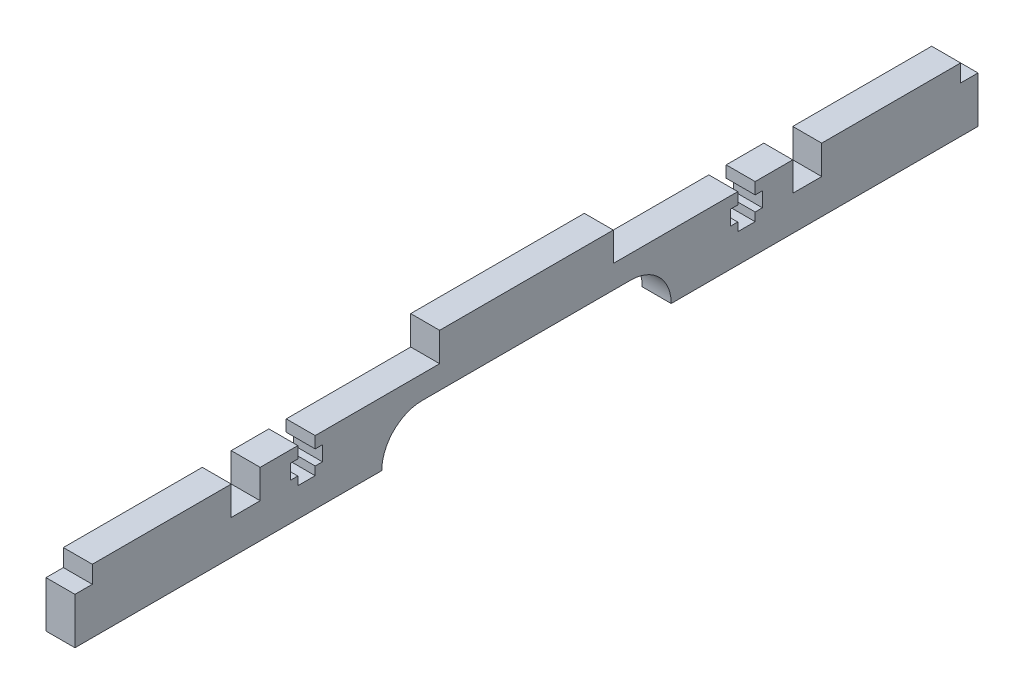
from build123d import *

# Parameters (mm, degrees)
SKETCH1_W           = 5
SKETCH1_H           = 11
BOSS_EXTRUDE1_DEPTH = 150
CUT_EXTRUDE1_DEPTH  = 161.573187019
SKETCH3_W           = 5
SKETCH3_H           = 30
BOSS_EXTRUDE2_DEPTH = 5
CUT_EXTRUDE2_DEPTH  = 163.417988138
SKETCH6_W           = 5
SKETCH6_H           = 8
BOSS_EXTRUDE3_DEPTH = 3
SKETCH7_W           = 5
SKETCH7_H           = 8
BOSS_EXTRUDE4_DEPTH = 3
SKETCH8_W           = 5
SKETCH8_H           = 5
CUT_EXTRUDE3_DEPTH  = 166.192623536


with BuildPart() as part:
    # Sketch1 → Boss-Extrude1 (new body)
    with BuildSketch(Plane.XY):
        with Locations((85.894042166, 51.58544814)):
            Rectangle(SKETCH1_W, SKETCH1_H)
    extrude(amount=BOSS_EXTRUDE1_DEPTH)

    # Sketch2 → Cut-Extrude1 (cut, through all)
    with BuildSketch(Plane(origin=(88.394042166, 0, 0), x_dir=(0, 0, -1), z_dir=(1, 0, 0))):
        with BuildLine():
            Line((-93, 53.08544814), (-57, 53.08544814))
            ThreePointArc((-57, 53.08544814), (-52.050252532, 51.035195608), (-50, 46.08544814))
            Line((-50, 46.08544814), (-100, 46.08544814))
            ThreePointArc((-100, 46.08544814), (-97.949747468, 51.035195608), (-93, 53.08544814))
        make_face()
    extrude(amount=-CUT_EXTRUDE1_DEPTH, mode=Mode.SUBTRACT)

    # Sketch3 → Boss-Extrude2 (add)
    with BuildSketch(Plane(origin=(0, 57.08544814, 0), x_dir=(1, 0, 0), z_dir=(0, 1, 0))):
        with Locations((85.894042166, -75)):
            Rectangle(SKETCH3_W, SKETCH3_H)
    extrude(amount=BOSS_EXTRUDE2_DEPTH)

    # Sketch5 → Cut-Extrude2 (cut, through all)
    with BuildSketch(Plane(origin=(88.394042166, 0, 0), x_dir=(0, 0, -1), z_dir=(1, 0, 0))):
        Polygon((-35.5, 55.08544814), (-34.25, 55.08544814), (-34.25, 52.53544814), (-35.5, 52.53544814), (-35.5, 51.08544814), (-38.5, 51.08544814), (-38.5, 52.53544814), (-39.75, 52.53544814), (-39.75, 55.08544814), (-38.5, 55.08544814), (-38.5, 57.08544814), (-35.5, 57.08544814), align=None)
        Polygon((-114.5, 52.53544814), (-115.75, 52.53544814), (-115.75, 55.08544814), (-114.5, 55.08544814), (-114.5, 57.08544814), (-111.5, 57.08544814), (-111.5, 55.08544814), (-110.25, 55.08544814), (-110.25, 52.53544814), (-111.5, 52.53544814), (-111.5, 51.08544814), (-114.5, 51.08544814), align=None)
    extrude(amount=-CUT_EXTRUDE2_DEPTH, mode=Mode.SUBTRACT)

    # Sketch6 → Boss-Extrude3 (add)
    with BuildSketch(Plane(origin=(0, 0, 0), x_dir=(-1, 0, 0), z_dir=(0, 0, -1))):
        with Locations((-85.894042166, 50.08544814)):
            Rectangle(SKETCH6_W, SKETCH6_H)
    extrude(amount=BOSS_EXTRUDE3_DEPTH)

    # Sketch7 → Boss-Extrude4 (add)
    with BuildSketch(Plane.XY.offset(150)):
        with Locations((85.894042166, 50.08544814)):
            Rectangle(SKETCH7_W, SKETCH7_H)
    extrude(amount=BOSS_EXTRUDE4_DEPTH)

    # Sketch8 → Cut-Extrude3 (cut, through all)
    with BuildSketch(Plane(origin=(88.394042166, 0, 0), x_dir=(0, 0, -1), z_dir=(1, 0, 0))):
        with Locations((-123.5, 54.58544814)):
            Rectangle(SKETCH8_W, SKETCH8_H)
        with Locations((-26.5, 54.58544814)):
            Rectangle(SKETCH8_W, SKETCH8_H)
    extrude(amount=-CUT_EXTRUDE3_DEPTH, mode=Mode.SUBTRACT)


solid = part.part
